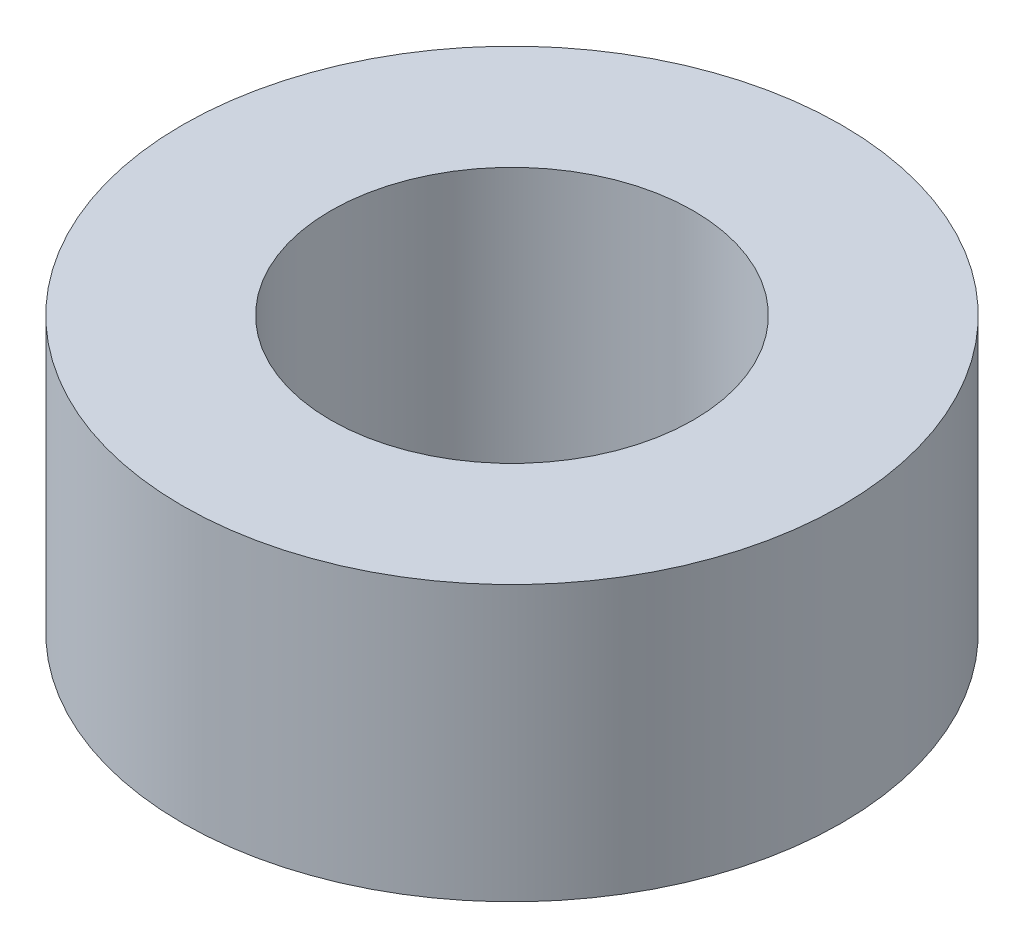
from build123d import *

# Parameters (mm, degrees)
SKETCH1_R           = 3
SKETCH1_R_2         = 1.65
BOSS_EXTRUDE1_DEPTH = 2.5


with BuildPart() as part:
    # Sketch1 → Boss-Extrude1 (new body)
    with BuildSketch(Plane(origin=(0, 0, 0), x_dir=(1, 0, 0), z_dir=(0, 1, 0))):
        with Locations(Location((0, 0, 0), (0, 0, 270))):
            Circle(SKETCH1_R)
        with Locations(Location((0, 0, 0), (0, 0, 270))):
            Circle(SKETCH1_R_2, mode=Mode.SUBTRACT)
    extrude(amount=BOSS_EXTRUDE1_DEPTH)


solid = part.part
